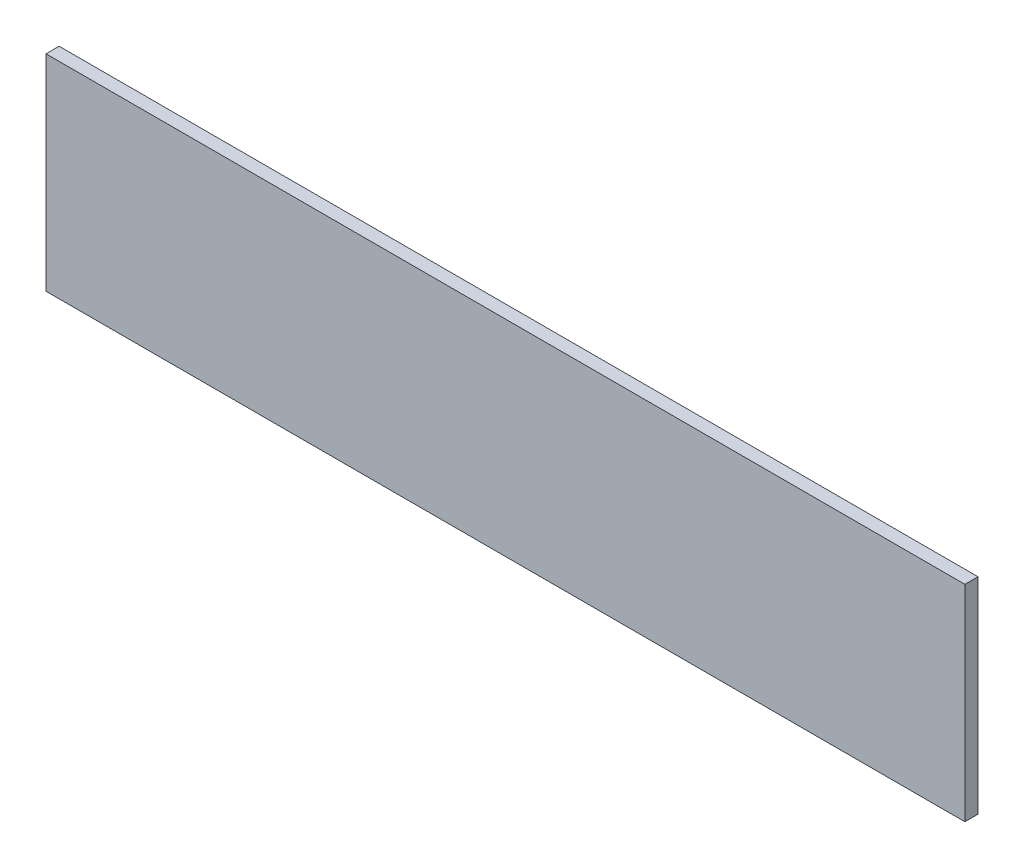
from build123d import *

# Parameters (mm, degrees)
SKETCH3_W           = 210
SKETCH3_H           = 3
BOSS_EXTRUDE1_DEPTH = 47


with BuildPart() as part:
    # Sketch3 → Boss-Extrude1 (new body)
    with BuildSketch(Plane(origin=(0, 0, 0), x_dir=(1, 0, 0), z_dir=(0, 1, 0))):
        with Locations((-73.523809524, 0.452380952)):
            Rectangle(SKETCH3_W, SKETCH3_H)
    extrude(amount=BOSS_EXTRUDE1_DEPTH)


solid = part.part
